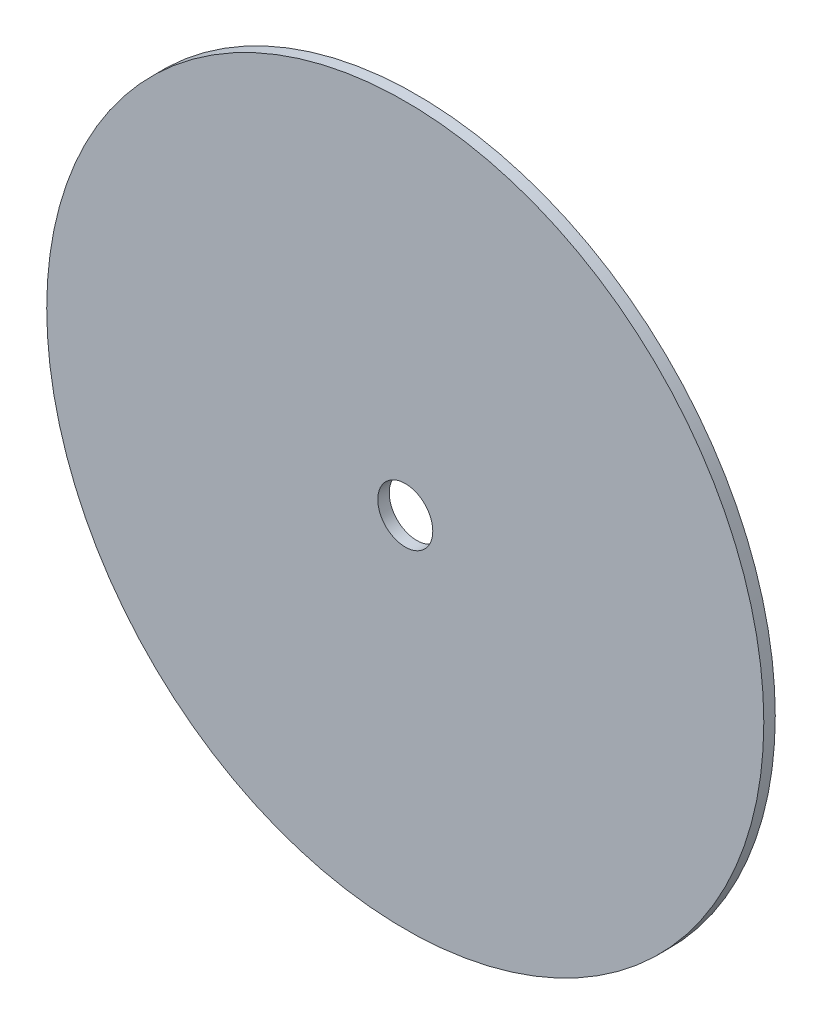
from build123d import *

# Parameters (mm, degrees)
SKETCH1_R           = 49.657
SKETCH1_R_2         = 3.81
BOSS_EXTRUDE1_DEPTH = 1.5875


with BuildPart() as part:
    # Sketch1 → Boss-Extrude1 (new body)
    with BuildSketch(Plane.XY):
        Circle(SKETCH1_R)
        Circle(SKETCH1_R_2, mode=Mode.SUBTRACT)
    extrude(amount=BOSS_EXTRUDE1_DEPTH)


solid = part.part
